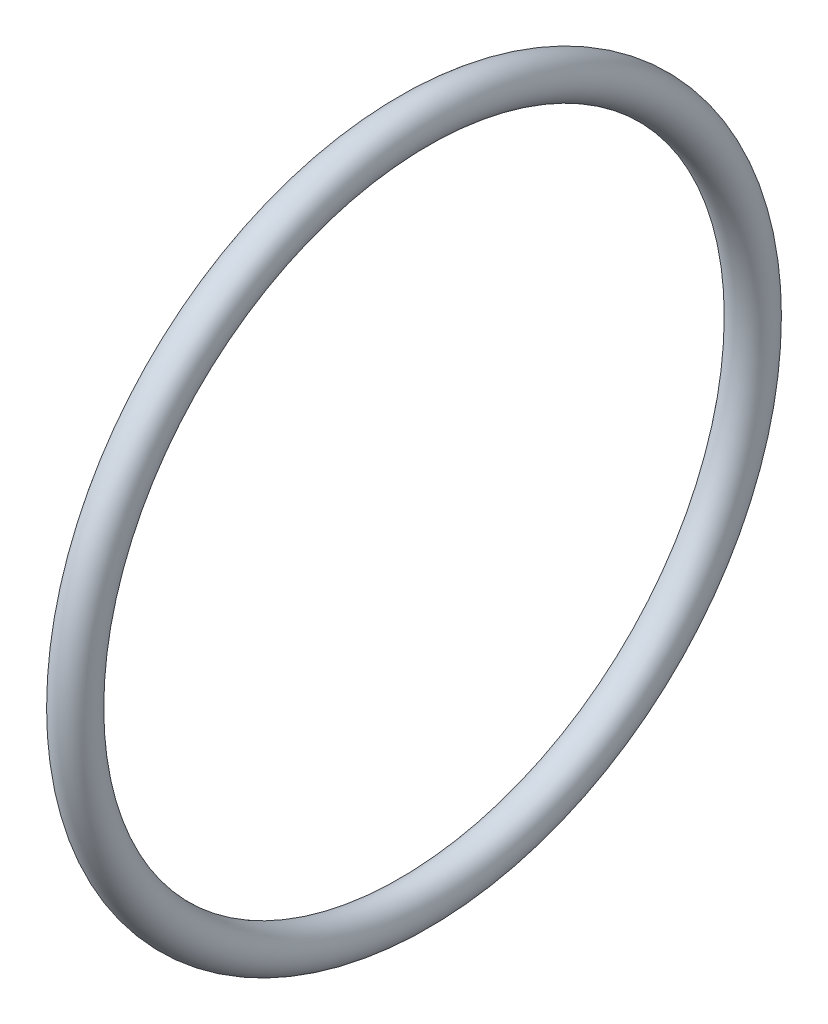
from build123d import *

# Parameters (mm, degrees)
ESQUISSE1_R = 1


with BuildPart() as part:
    # Esquisse1 → Révolution1 (revolve)
    with BuildSketch(Plane.XY):
        with Locations((0, 16.75)):
            Circle(ESQUISSE1_R)
    revolve(axis=Axis((-46.375819672, 0, 0), (1, 0, 0)))


solid = part.part
